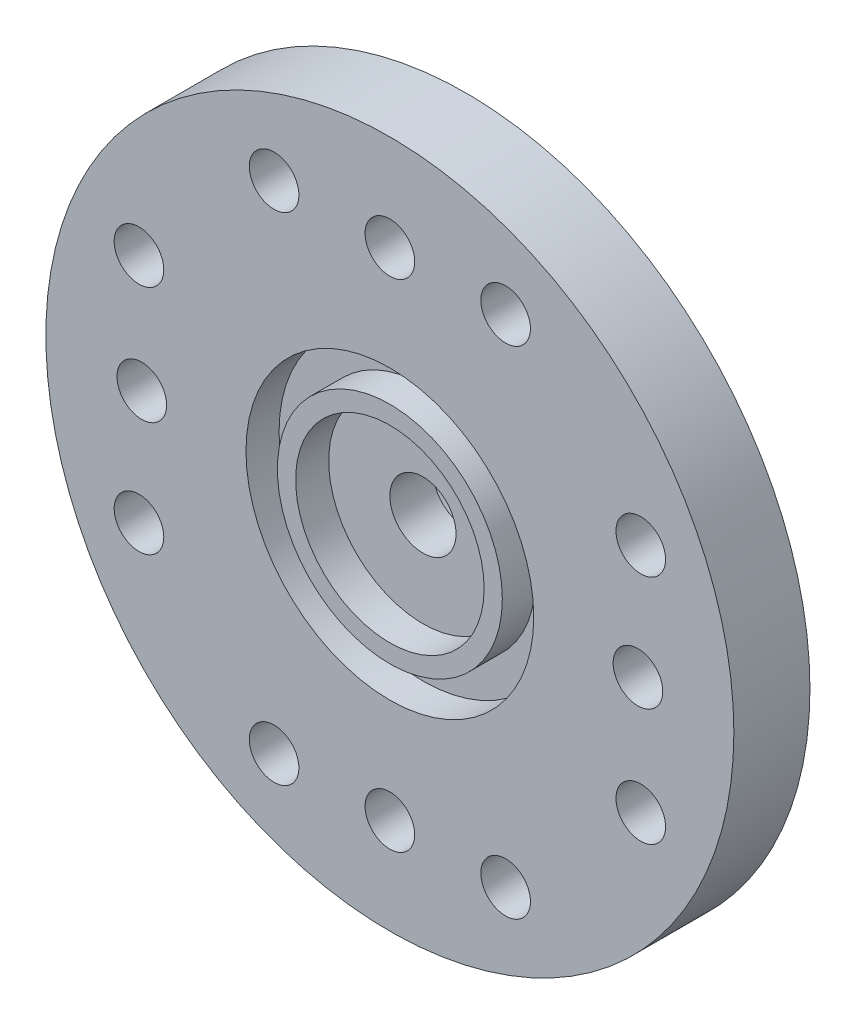
from build123d import *

# Parameters (mm, degrees)
SKETCH1_R                    = 10.4
BOSS_EXTRUDE1_DEPTH          = 2.3
F_96_0_0063_DIAMETER_HOLE1_D = 1.500000048
SKETCH9_R                    = 4.4
SKETCH9_R_2                  = 3
BOSS_EXTRUDE2_DEPTH          = 3
SKETCH10_R                   = 4.35
SKETCH10_R_2                 = 3.4
CUT_EXTRUDE1_DEPTH           = 1
SKETCH11_R                   = 2.85
CUT_EXTRUDE2_DEPTH           = 1
SKETCH12_R                   = 1
CUT_EXTRUDE3_DEPTH           = 4


with BuildPart() as part:
    # Sketch1 → Boss-Extrude1 (new body)
    with BuildSketch(Plane.XY):
        Circle(SKETCH1_R)
    extrude(amount=BOSS_EXTRUDE1_DEPTH)

    # #96 (0.0063) Diameter Hole1 (through all)
    with Locations(Plane.XY.offset(2.3)):
        with Locations((0, 7.5), (-3.5, 7.5), (3.5, 7.5), (-7.5, 0), (-7.584790225, 3.5), (-7.584790225, -3.5)):
            f_96_0_0063_diameter_hole1 = Hole(F_96_0_0063_DIAMETER_HOLE1_D / 2)

    # Mirror1: #96 (0.0063) Diameter Hole1 across plane
    add(f_96_0_0063_diameter_hole1.mirror(Plane.ZX), mode=Mode.SUBTRACT)

    # Mirror2: #96 (0.0063) Diameter Hole1 across plane
    add(f_96_0_0063_diameter_hole1.mirror(Plane(origin=(0, 0, 0), x_dir=(0, 0, 1), z_dir=(1, 0, 0))), mode=Mode.SUBTRACT)

    # Sketch9 → Boss-Extrude2 (add)
    with BuildSketch(Plane(origin=(0, 0, 0), x_dir=(-1, 0, 0), z_dir=(0, 0, -1))):
        with Locations(Location((0, 0, 0), (0, 0, 180))):
            Circle(SKETCH9_R)
        Circle(SKETCH9_R_2, mode=Mode.SUBTRACT)
    extrude(amount=BOSS_EXTRUDE2_DEPTH)

    # Sketch10 → Cut-Extrude1 (cut)
    with BuildSketch(Plane.XY.offset(2.3)):
        Circle(SKETCH10_R)
        Circle(SKETCH10_R_2, mode=Mode.SUBTRACT)
    extrude(amount=-CUT_EXTRUDE1_DEPTH, mode=Mode.SUBTRACT)

    # Sketch11 → Cut-Extrude2 (cut)
    with BuildSketch(Plane.XY.offset(2.3)):
        Circle(SKETCH11_R)
    extrude(amount=-CUT_EXTRUDE2_DEPTH, mode=Mode.SUBTRACT)

    # Sketch12 → Cut-Extrude3 (cut)
    with BuildSketch(Plane.XY.offset(1.3)):
        Circle(SKETCH12_R)
    extrude(amount=-CUT_EXTRUDE3_DEPTH, mode=Mode.SUBTRACT)


solid = part.part
